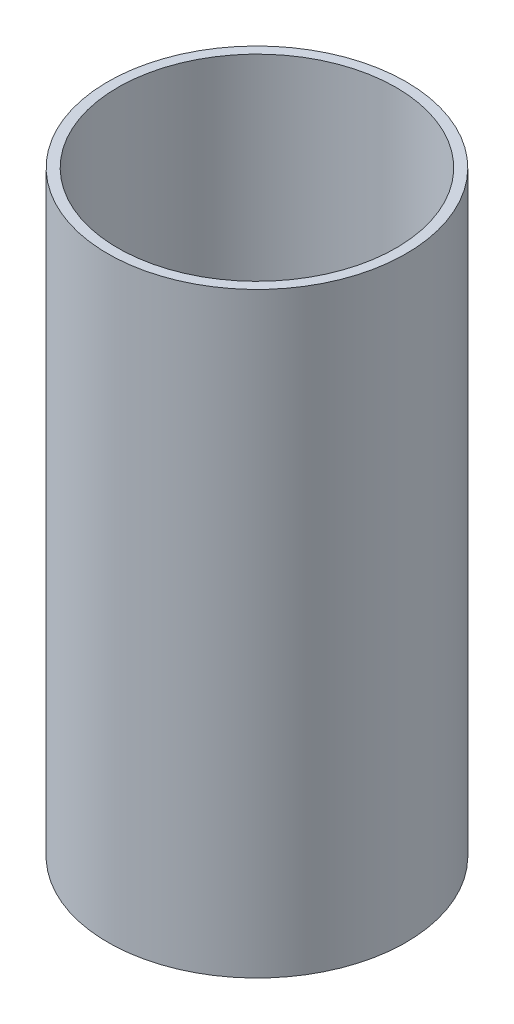
from build123d import *

# Parameters (mm, degrees)
SKETCH_1_R      = 22.5
SKETCH_1_R_2    = 21
EXTRUDE_1_DEPTH = 90


with BuildPart() as part:
    # 草图1 → 凸台-拉伸1 (new body)
    with BuildSketch(Plane(origin=(0, 0, 0), x_dir=(1, 0, 0), z_dir=(0, 1, 0))):
        with Locations(Location((0, 0, 0), (0, 0, 90))):
            Circle(SKETCH_1_R)
        with Locations(Location((0, 0, 0), (0, 0, 90))):
            Circle(SKETCH_1_R_2, mode=Mode.SUBTRACT)
    extrude(amount=EXTRUDE_1_DEPTH)


solid = part.part
